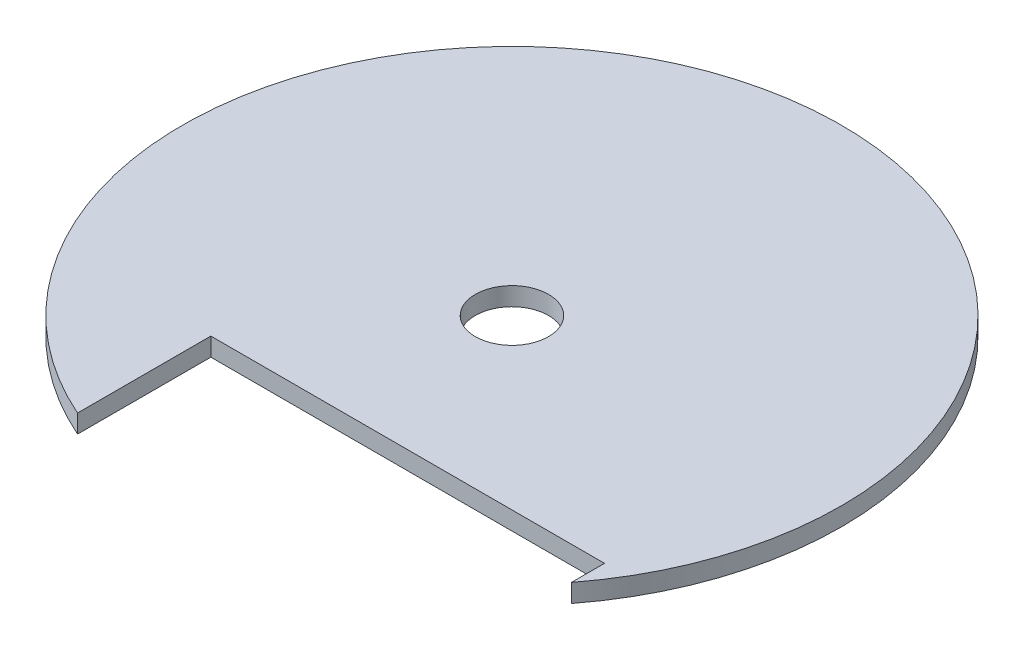
from build123d import *

# Parameters (mm, degrees)
SKETCH1_R           = 36
SKETCH1_R_2         = 4
BOSS_EXTRUDE1_DEPTH = 2
SKETCH2_W           = 43
SKETCH2_H           = 43
CUT_EXTRUDE1_DEPTH  = 51.950956811


with BuildPart() as part:
    # Sketch1 → Boss-Extrude1 (new body)
    with BuildSketch(Plane(origin=(0, 0, 0), x_dir=(1, 0, 0), z_dir=(0, 1, 0))):
        with Locations(Location((0, 0, 0), (0, 0, 270))):
            Circle(SKETCH1_R)
        with Locations(Location((0, 0, 0), (0, 0, 270))):
            Circle(SKETCH1_R_2, mode=Mode.SUBTRACT)
    extrude(amount=BOSS_EXTRUDE1_DEPTH)

    # Sketch2 → Cut-Extrude1 (cut, through all)
    with BuildSketch(Plane(origin=(0, 2, 0), x_dir=(1, 0, 0), z_dir=(0, 1, 0))):
        with Locations((7, -39.890475054)):
            Rectangle(SKETCH2_W, SKETCH2_H)
    extrude(amount=-CUT_EXTRUDE1_DEPTH, mode=Mode.SUBTRACT)


solid = part.part
